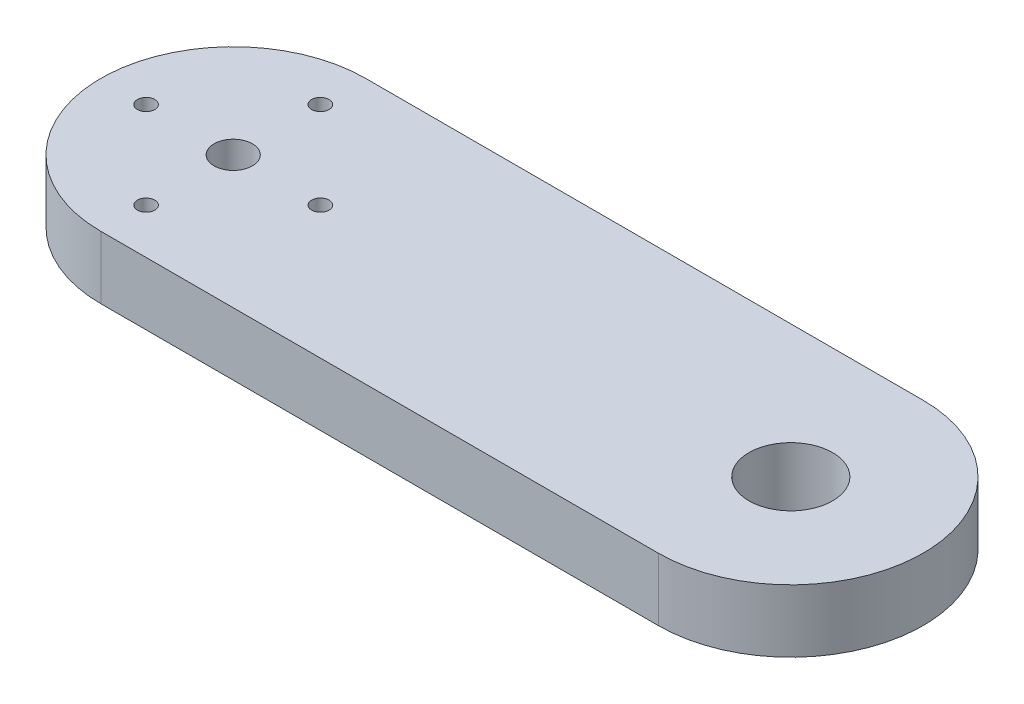
from build123d import *

# Parameters (mm, degrees)
SKETCH_1_R         = 2.75
SKETCH_1_R_2       = 6
EXTRUDE_1_DEPTH    = 9
HOLE_WIZARD_M3_1_D = 2.5


with BuildPart() as part:
    # 草图1 → 凸台-拉伸1 (new body)
    with BuildSketch(Plane(origin=(0, 0, 0), x_dir=(1, 0, 0), z_dir=(0, 1, 0))):
        with BuildLine():
            Line((0, 19), (80, 19))
            ThreePointArc((80, 19), (99, 0), (80, -19))
            Line((80, -19), (0, -19))
            ThreePointArc((0, -19), (-19, 0), (0, 19))
        make_face()
        with Locations(Location((0, 0, 0), (0, 0, 270))):
            Circle(SKETCH_1_R, mode=Mode.SUBTRACT)
        with Locations(Location((80, 0, 0), (0, 0, 270))):
            Circle(SKETCH_1_R_2, mode=Mode.SUBTRACT)
    extrude(amount=EXTRUDE_1_DEPTH)

    # M3 螺纹孔的螺纹孔钻头1 (through all)
    with Locations(Plane(origin=(0, 9, -12.5), x_dir=(0, 0, 1), z_dir=(0, 1, 0))):
        with Locations((0, 0), (12.5, 12.5), (25, 0), (12.5, -12.5)):
            Hole(HOLE_WIZARD_M3_1_D / 2)


solid = part.part
